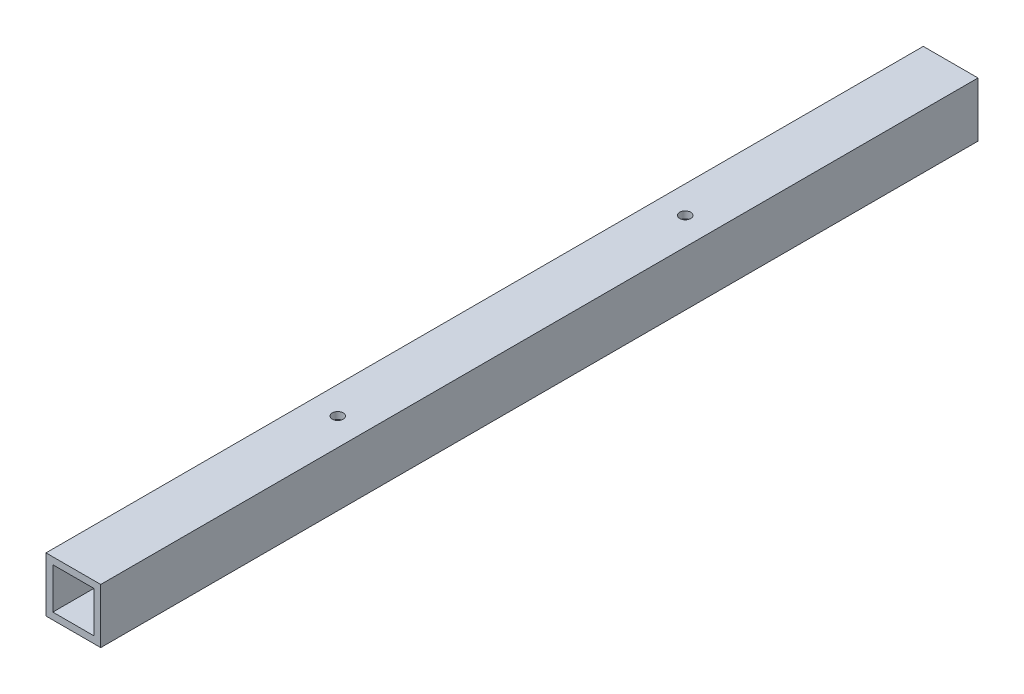
from build123d import *

# Parameters (mm, degrees)
SKETCH1_W              = 25.4
SKETCH1_H              = 25.4
SKETCH1_W_2            = 19.05
SKETCH1_H_2            = 19.05
BOSS_EXTRUDE1_DEPTH    = 407.19375
F_10_CLEARANCE_HOLE1_D = 5.1054
CUT_EXTRUDE1_REACH     = 410.183
SKETCH4_R              = 7.62


with BuildPart() as part:
    # Sketch1 → Boss-Extrude1 (new body)
    with BuildSketch(Plane.XY):
        Rectangle(SKETCH1_W, SKETCH1_H)
        Rectangle(SKETCH1_W_2, SKETCH1_H_2, mode=Mode.SUBTRACT)
    extrude(amount=BOSS_EXTRUDE1_DEPTH)

    # #10 Clearance Hole1 (through all)
    with Locations(Plane(origin=(146.05, 12.7, 546.735), x_dir=(0, 0, 1), z_dir=(0, 1, 0))):
        with Locations((-423.545, -146.05), (-262.255, -146.05)):
            Hole(F_10_CLEARANCE_HOLE1_D / 2)

    # Sketch4 → Cut-Extrude1 (cut, up to next)
    with BuildSketch(Plane(origin=(0, -12.7, 0), x_dir=(1, 0, 0), z_dir=(0, 1, 0)), mode=Mode.PRIVATE) as cut_extrude1_sk1:
        with Locations(Location((0, -123.19, 0), (0, 0, 90))):
            Circle(SKETCH4_R)
    cut_extrude1_tool1 = extrude(cut_extrude1_sk1.sketch, amount=CUT_EXTRUDE1_REACH, mode=Mode.PRIVATE) & part.part
    # Sketch4 → Cut-Extrude1 (cut, up to next)
    with BuildSketch(Plane(origin=(0, -12.7, 0), x_dir=(1, 0, 0), z_dir=(0, 1, 0)), mode=Mode.PRIVATE) as cut_extrude1_sk2:
        with Locations(Location((0, -284.48, 0), (0, 0, 90))):
            Circle(SKETCH4_R)
    cut_extrude1_tool2 = extrude(cut_extrude1_sk2.sketch, amount=CUT_EXTRUDE1_REACH, mode=Mode.PRIVATE) & part.part
    add(cut_extrude1_tool1.solids().sort_by_distance((0, -12.7, 123.19))[0], mode=Mode.SUBTRACT)
    add(cut_extrude1_tool2.solids().sort_by_distance((0, -12.7, 284.48))[0], mode=Mode.SUBTRACT)


solid = part.part
